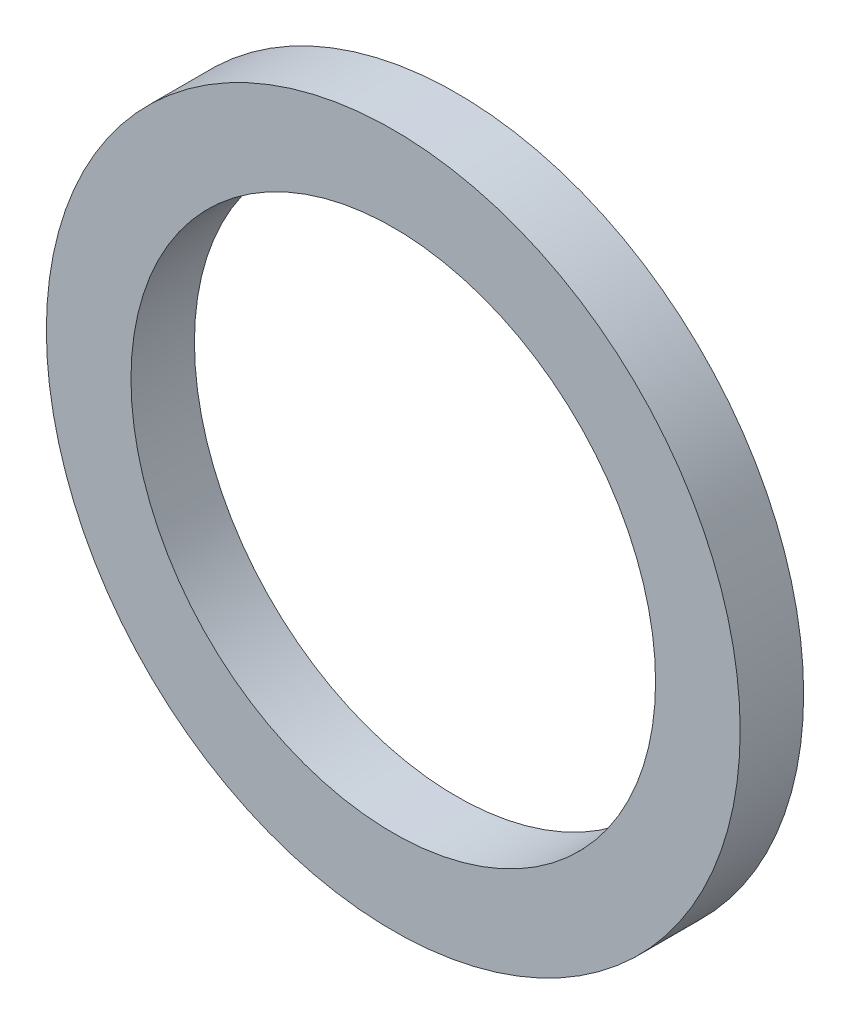
from build123d import *

# Parameters (mm, degrees)
ESQUISSE1_R          = 4.1
ESQUISSE1_R_2        = 3.1
BASE_EXTRUSION_DEPTH = 0.75


with BuildPart() as part:
    # Esquisse1 → Base-Extrusion (new body)
    with BuildSketch(Plane.XY):
        Circle(ESQUISSE1_R)
        Circle(ESQUISSE1_R_2, mode=Mode.SUBTRACT)
    extrude(amount=BASE_EXTRUSION_DEPTH)


solid = part.part
